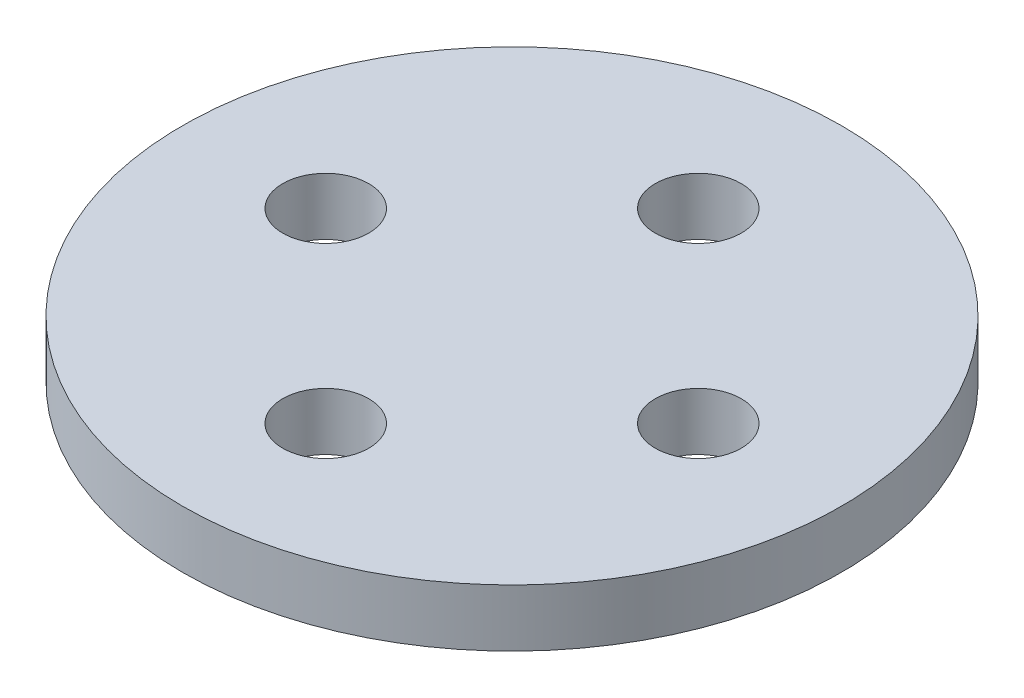
from build123d import *

# Parameters (mm, degrees)
SKETCH1_R           = 11.5
BOSS_EXTRUDE1_DEPTH = 2
SKETCH2_R           = 1.5
CUT_EXTRUDE1_DEPTH  = 17.385969608


with BuildPart() as part:
    # Sketch1 → Boss-Extrude1 (new body)
    with BuildSketch(Plane(origin=(0, 0, 0), x_dir=(1, 0, 0), z_dir=(0, 1, 0))):
        with Locations(Location((0, 0, 0), (0, 0, 270))):
            Circle(SKETCH1_R)
    extrude(amount=BOSS_EXTRUDE1_DEPTH)

    # Sketch2 → Cut-Extrude1 (cut, through all)
    with BuildSketch(Plane.XZ):
        with Locations(Location((6.5, 0, 0), (0, 0, 270))):
            Circle(SKETCH2_R)
        with Locations(Location((0, -6.5, 0), (0, 0, 270))):
            Circle(SKETCH2_R)
        with Locations(Location((-6.5, 0, 0), (0, 0, 270))):
            Circle(SKETCH2_R)
        with Locations(Location((0, 6.5, 0), (0, 0, 270))):
            Circle(SKETCH2_R)
    extrude(amount=-CUT_EXTRUDE1_DEPTH, mode=Mode.SUBTRACT)


solid = part.part
